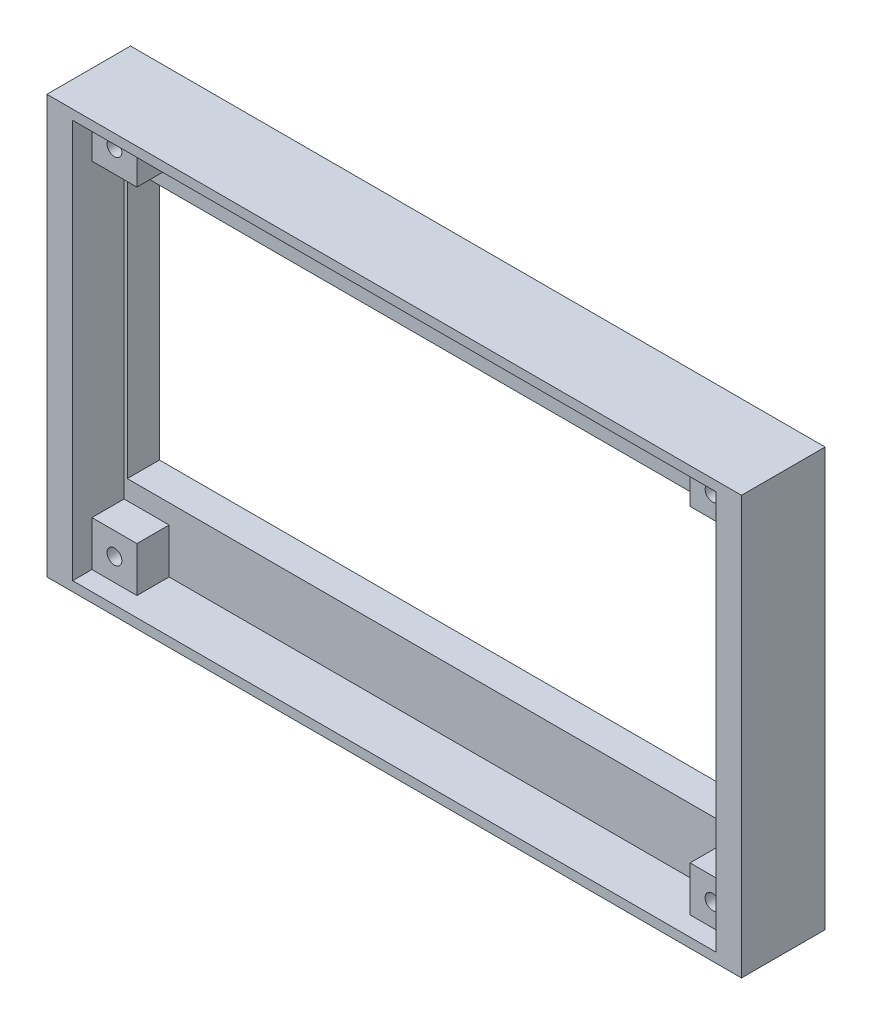
from build123d import *

# Parameters (mm, degrees)
SKETCH_1_W          = 108
SKETCH_1_H          = 65
SKETCH_1_W_2        = 99
SKETCH_1_H_2        = 42
EXTRUDE_1_DEPTH     = 5
SKETCH_2_W          = 108
SKETCH_2_H          = 65
SKETCH_2_W_2        = 100
SKETCH_2_H_2        = 62
SKETCH_2_W_3        = 7
SKETCH_2_H_3        = 7
EXTRUDE_2_DEPTH     = 5
SKETCH_3_W          = 108
SKETCH_3_H          = 65
EXTRUDE_4_DEPTH     = 3
SKETCH_4_R          = 1.15
CUT_EXTRUDE_1_DEPTH = 7


with BuildPart() as part:
    # 草圖1 → 填料-伸長1 (new body)
    with BuildSketch(Plane.XY):
        with Locations((10.575206568, -6.470178926)):
            Rectangle(SKETCH_1_W, SKETCH_1_H)
        with Locations((10.575206568, -6.470178926)):
            Rectangle(SKETCH_1_W_2, SKETCH_1_H_2, mode=Mode.SUBTRACT)
    extrude(amount=EXTRUDE_1_DEPTH)

    # 草圖2 → 填料-伸長2 (add)
    # profile 1 of 5: a face of its own
    with BuildSketch(Plane.XY.offset(5)):
        with Locations((10.575206568, -6.470178926)):
            Rectangle(SKETCH_2_W, SKETCH_2_H)
        with Locations((10.575206568, -6.470178926)):
            Rectangle(SKETCH_2_W_2, SKETCH_2_H_2, mode=Mode.SUBTRACT)
    # profile 2 of 5: a face of its own
    with BuildSketch(Plane.XY.offset(5)):
        with Locations((-35.924793432, 21.029821074)):
            Rectangle(SKETCH_2_W_3, SKETCH_2_H_3)
    # profile 3 of 5: a face of its own
    with BuildSketch(Plane.XY.offset(5)):
        with Locations((57.075206568, 21.029821074)):
            Rectangle(SKETCH_2_W_3, SKETCH_2_H_3)
    # profile 4 of 5: a face of its own
    with BuildSketch(Plane.XY.offset(5)):
        with Locations((57.075206568, -33.970178926)):
            Rectangle(SKETCH_2_W_3, SKETCH_2_H_3)
    # profile 5 of 5: a face of its own
    with BuildSketch(Plane.XY.offset(5)):
        with Locations((-35.924793432, -33.970178926)):
            Rectangle(SKETCH_2_W_3, SKETCH_2_H_3)
    extrude(amount=EXTRUDE_2_DEPTH)

    # 草圖3 → 填料-伸長4 (add)
    with BuildSketch(Plane.XY.offset(10)):
        with Locations((10.575206568, -6.470178926)):
            Rectangle(SKETCH_3_W, SKETCH_3_H)
        Polygon((-39.424793432, -37.470178926), (-32.424793432, -37.470178926), (53.575206568, -37.470178926), (60.575206568, -37.470178926), (60.575206568, -30.470178926), (60.575206568, 17.529821074), (60.575206568, 24.529821074), (53.575206568, 24.529821074), (-32.424793432, 24.529821074), (-39.424793432, 24.529821074), (-39.424793432, 17.529821074), (-39.424793432, -30.470178926), align=None, mode=Mode.SUBTRACT)
    extrude(amount=EXTRUDE_4_DEPTH)

    # 草圖4 → 除料-伸長1 (cut)
    with BuildSketch(Plane.XY.offset(10)):
        with Locations((-35.924793432, 21.029821074)):
            Circle(SKETCH_4_R)
        with Locations((57.075206568, 21.029821074)):
            Circle(SKETCH_4_R)
        with Locations((57.075206568, -33.970178926)):
            Circle(SKETCH_4_R)
        with Locations((-35.924793432, -33.970178926)):
            Circle(SKETCH_4_R)
    extrude(amount=-CUT_EXTRUDE_1_DEPTH, mode=Mode.SUBTRACT)


solid = part.part
